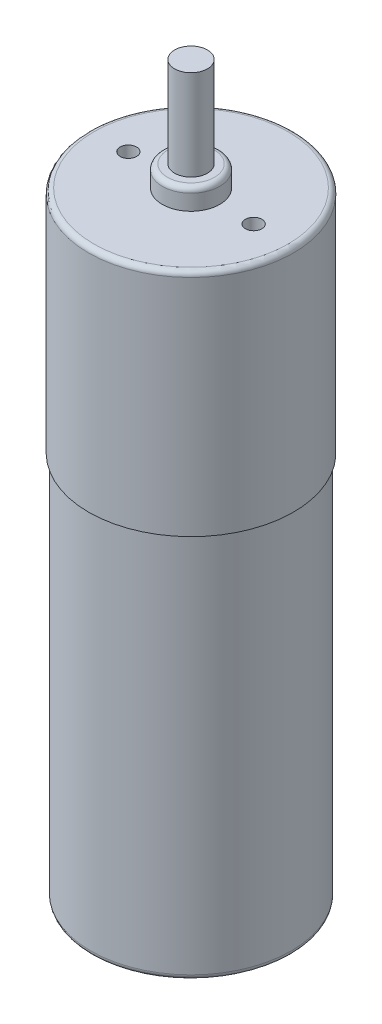
from build123d import *

# Parameters (mm, degrees)
SKETCH1_R           = 12.192
BOSS_EXTRUDE1_DEPTH = 46.99
SKETCH2_R           = 12.4587
BOSS_EXTRUDE2_DEPTH = 27.94
SKETCH3_R           = 3.4925
BOSS_EXTRUDE3_DEPTH = 2.54
SKETCH4_R           = 1.9939
BOSS_EXTRUDE4_DEPTH = 10.9982
FILLET1_R           = 0.635
FILLET2_R           = 0.635
SKETCH5_R           = 1.0033
CUT_EXTRUDE1_DEPTH  = 12.7


with BuildPart() as part:
    # Sketch1 → Boss-Extrude1 (new body)
    with BuildSketch(Plane(origin=(0, 0, 0), x_dir=(1, 0, 0), z_dir=(0, 1, 0))):
        with Locations(Location((0, 0, 0), (0, 0, 270))):
            Circle(SKETCH1_R)
    extrude(amount=BOSS_EXTRUDE1_DEPTH)

    # Sketch2 → Boss-Extrude2 (add)
    with BuildSketch(Plane(origin=(0, 46.99, 0), x_dir=(1, 0, 0), z_dir=(0, 1, 0))):
        with Locations(Location((0, 0, 0), (0, 0, 270))):
            Circle(SKETCH2_R)
    extrude(amount=BOSS_EXTRUDE2_DEPTH)

    # Sketch3 → Boss-Extrude3 (add)
    with BuildSketch(Plane(origin=(0, 74.93, 0), x_dir=(1, 0, 0), z_dir=(0, 1, 0))):
        with Locations(Location((0, 0, 0), (0, 0, 270))):
            Circle(SKETCH3_R)
    extrude(amount=BOSS_EXTRUDE3_DEPTH)

    # Sketch4 → Boss-Extrude4 (add)
    with BuildSketch(Plane(origin=(0, 77.47, 0), x_dir=(1, 0, 0), z_dir=(0, 1, 0))):
        with Locations(Location((0, 0, 0), (0, 0, 270))):
            Circle(SKETCH4_R)
    extrude(amount=BOSS_EXTRUDE4_DEPTH)

    # Fillet1
    fillet1_edges = [part.edges().sort_by_distance(p)[0] for p in [
        (0, 0, -12.192),
        (0, 74.93, -12.4587),
    ]]
    fillet(fillet1_edges, radius=FILLET1_R)

    # Fillet2
    fillet2_edges = [part.edges().sort_by_distance(p)[0] for p in [
        (0, 77.47, -3.4925),
    ]]
    fillet(fillet2_edges, radius=FILLET2_R)

    # Sketch5 → Cut-Extrude1 (cut)
    with BuildSketch(Plane(origin=(0, 74.93, 0), x_dir=(1, 0, 0), z_dir=(0, 1, 0))):
        with Locations(Location((7.62, 0, 0), (0, 0, 270))):
            Circle(SKETCH5_R)
        with Locations(Location((-7.62, 0, 0), (0, 0, 90))):
            Circle(SKETCH5_R)
    extrude(amount=-CUT_EXTRUDE1_DEPTH, mode=Mode.SUBTRACT)


solid = part.part
